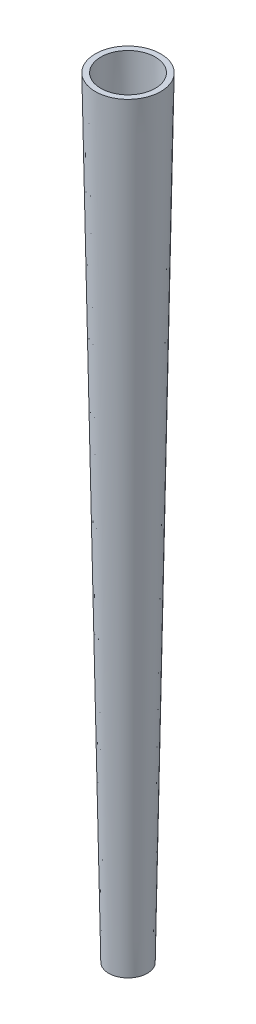
from build123d import *


with BuildPart() as part:
    # Sketch1 → Revolve2 (revolve)
    with BuildSketch(Plane.XY, mode=Mode.PRIVATE) as revolve2_sk:
        Polygon((-2.517455065, 1), (-4.94370909, 140), (-5.943861418, 140), (-3.500152328, 0), (-2.5, 0), (0, 0), (0, 1), align=None)
    revolve(revolve2_sk.sketch.rotate(Axis((0, 0, 0), (0, 1, 0)), 270), axis=Axis((0, 0, 0), (0, 1, 0)))


solid = part.part
